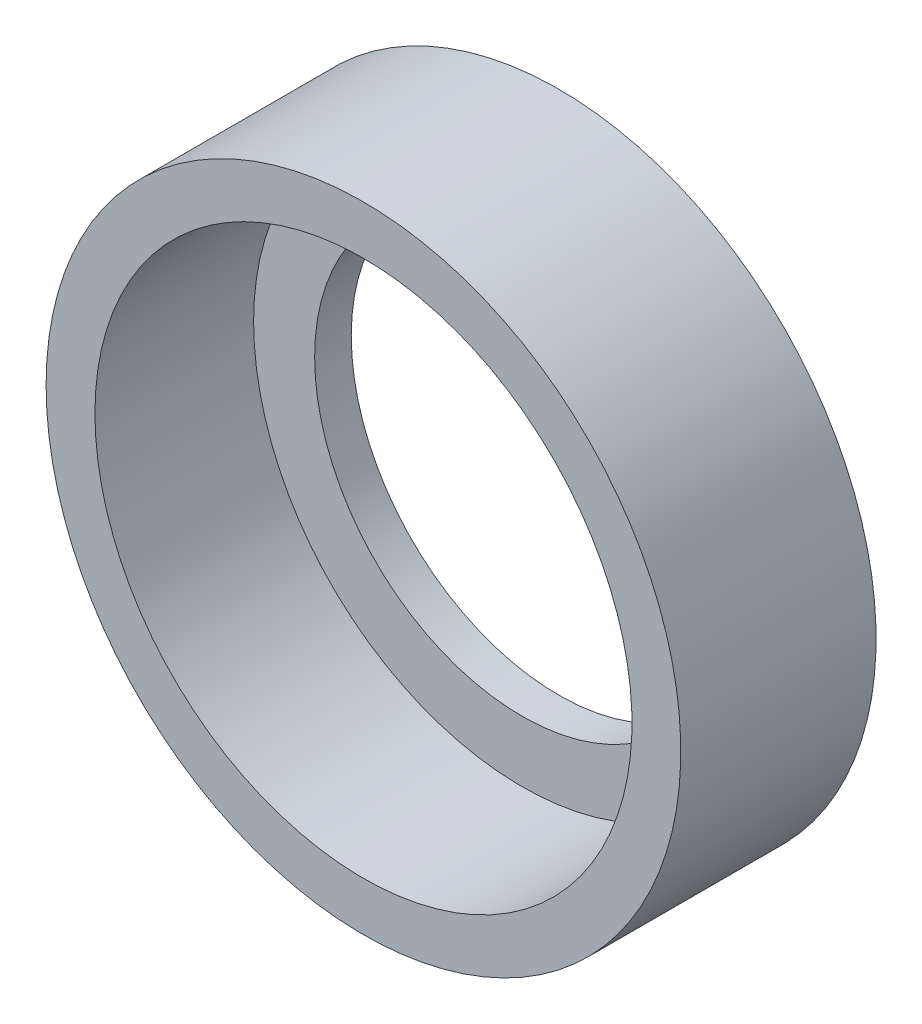
from build123d import *


with BuildPart() as part:
    # Esquisse1 → Révolution1 (revolve)
    with BuildSketch(Plane(origin=(0, 0, 0), x_dir=(0, 0, -1), z_dir=(1, 0, 0)), mode=Mode.PRIVATE) as r_volution1_sk:
        Polygon((-8, 13), (-8, 11), (-1.5, 11), (-1.5, 8.5), (0, 8.5), (0, 13), align=None)
    revolve(r_volution1_sk.sketch.rotate(Axis((0, 0, 0), (0, 0, 1)), 90), axis=Axis((0, 0, 0), (0, 0, 1)))


solid = part.part
